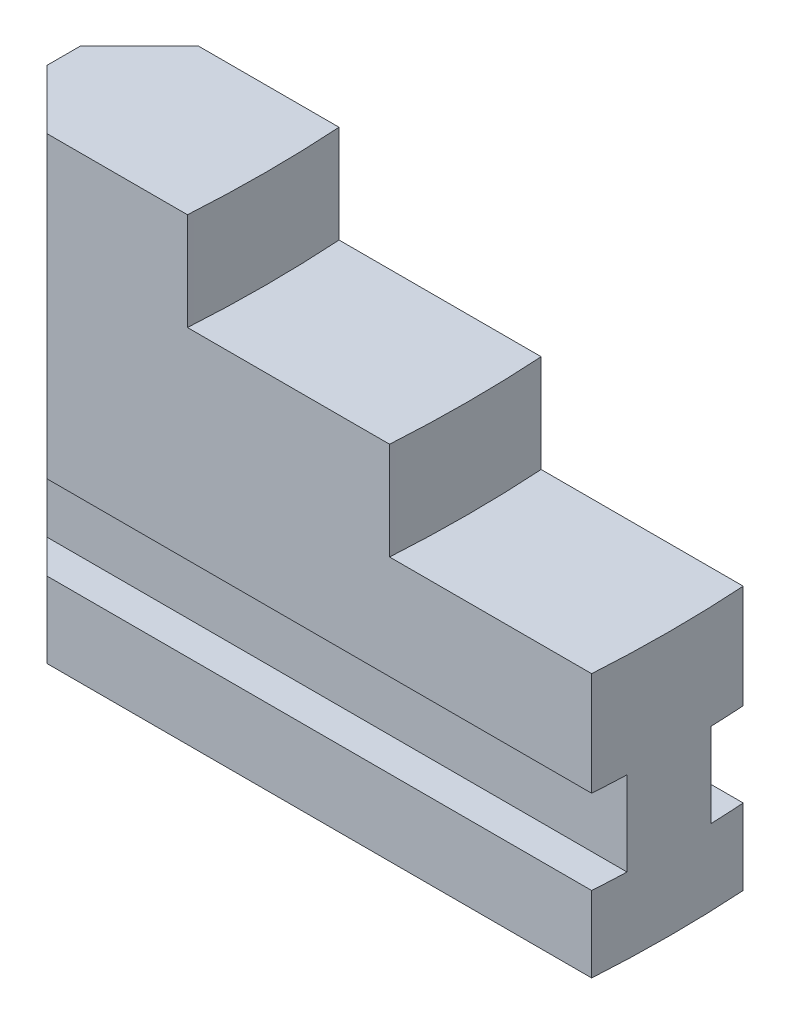
from build123d import *

# Parameters (mm, degrees)
BOSS_EXTRUDE1_DEPTH = 9
SKETCH3_W           = 4
SKETCH3_H           = 10
CUT_EXTRUDE2_DEPTH  = 91.748278221
CUT_EXTRUDE3_START  = 11.6
CUT_EXTRUDE3_DEPTH  = 11.6
CUT_EXTRUDE7_DEPTH  = 11.6
CUT_EXTRUDE8_START  = -11.6
CUT_EXTRUDE8_DEPTH  = 31.3
CHAMFER1_SIZE       = 7


with BuildPart() as part:
    # Sketch1 → Boss-Extrude1 (new, symmetric)
    with BuildSketch(Plane.XY):
        Polygon((0, 0), (0, 54.5), (24, 54.5), (24, 42.9), (48, 42.9), (48, 31.3), (72, 31.3), (72, 0), align=None)
    extrude(amount=BOSS_EXTRUDE1_DEPTH, both=True)

    # Sketch3 → Cut-Extrude2 (cut, through all)
    with BuildSketch(Plane.ZY):
        with Locations((-7, 14)):
            Rectangle(SKETCH3_W, SKETCH3_H)
        with Locations((7, 14)):
            Rectangle(SKETCH3_W, SKETCH3_H)
    extrude(amount=-CUT_EXTRUDE2_DEPTH, mode=Mode.SUBTRACT)

    # Sketch4 → Cut-Extrude3 (cut)
    with BuildSketch(Plane(origin=(0, 42.9, 0), x_dir=(1, 0, 0), z_dir=(0, 1, 0)).offset(CUT_EXTRUDE3_START)):
        with BuildLine():
            Line((49.710414787, -9), (47.710414787, -9))
            ThreePointArc((47.710414787, -9), (48, 0), (47.710414787, 9))
            Line((47.710414787, 9), (49.710414787, 9))
            Line((49.710414787, 9), (49.710414787, -9))
        make_face()
        with BuildLine():
            Line((23.710414787, 9), (25.710414787, 9))
            Line((25.710414787, 9), (25.710414787, -9))
            Line((25.710414787, -9), (23.710414787, -9))
            ThreePointArc((23.710414787, -9), (24, 0), (23.710414787, 9))
        make_face()
        with BuildLine():
            Line((73.710414787, -9), (71.710414787, -9))
            ThreePointArc((71.710414787, -9), (72, 0), (71.710414787, 9))
            Line((71.710414787, 9), (73.710414787, 9))
            Line((73.710414787, 9), (73.710414787, -9))
        make_face()
    extrude(amount=-CUT_EXTRUDE3_DEPTH, mode=Mode.SUBTRACT)

    # Sketch4<3> → Cut-Extrude7 (cut)
    with BuildSketch(Plane(origin=(0, 42.9, 0), x_dir=(1, 0, 0), z_dir=(0, 1, 0))):
        with BuildLine():
            Line((49.710414787, -9), (47.710414787, -9))
            ThreePointArc((47.710414787, -9), (48, 0), (47.710414787, 9))
            Line((47.710414787, 9), (49.710414787, 9))
            Line((49.710414787, 9), (49.710414787, -9))
        make_face()
    extrude(amount=-CUT_EXTRUDE7_DEPTH, mode=Mode.SUBTRACT)

    # Sketch4<4> → Cut-Extrude8 (cut)
    with BuildSketch(Plane(origin=(0, 42.9, 0), x_dir=(1, 0, 0), z_dir=(0, 1, 0)).offset(CUT_EXTRUDE8_START)):
        with BuildLine():
            Line((73.710414787, -9), (71.710414787, -9))
            ThreePointArc((71.710414787, -9), (72, 0), (71.710414787, 9))
            Line((71.710414787, 9), (73.710414787, 9))
            Line((73.710414787, 9), (73.710414787, -9))
        make_face()
    extrude(amount=-CUT_EXTRUDE8_DEPTH, mode=Mode.SUBTRACT)

    # Chamfer1
    chamfer1_edges = [part.edges().sort_by_distance(p)[0] for p in [
        (0, 36.75, -9),
        (0, 36.75, 9),
    ]]
    chamfer(chamfer1_edges, length=CHAMFER1_SIZE)


solid = part.part
